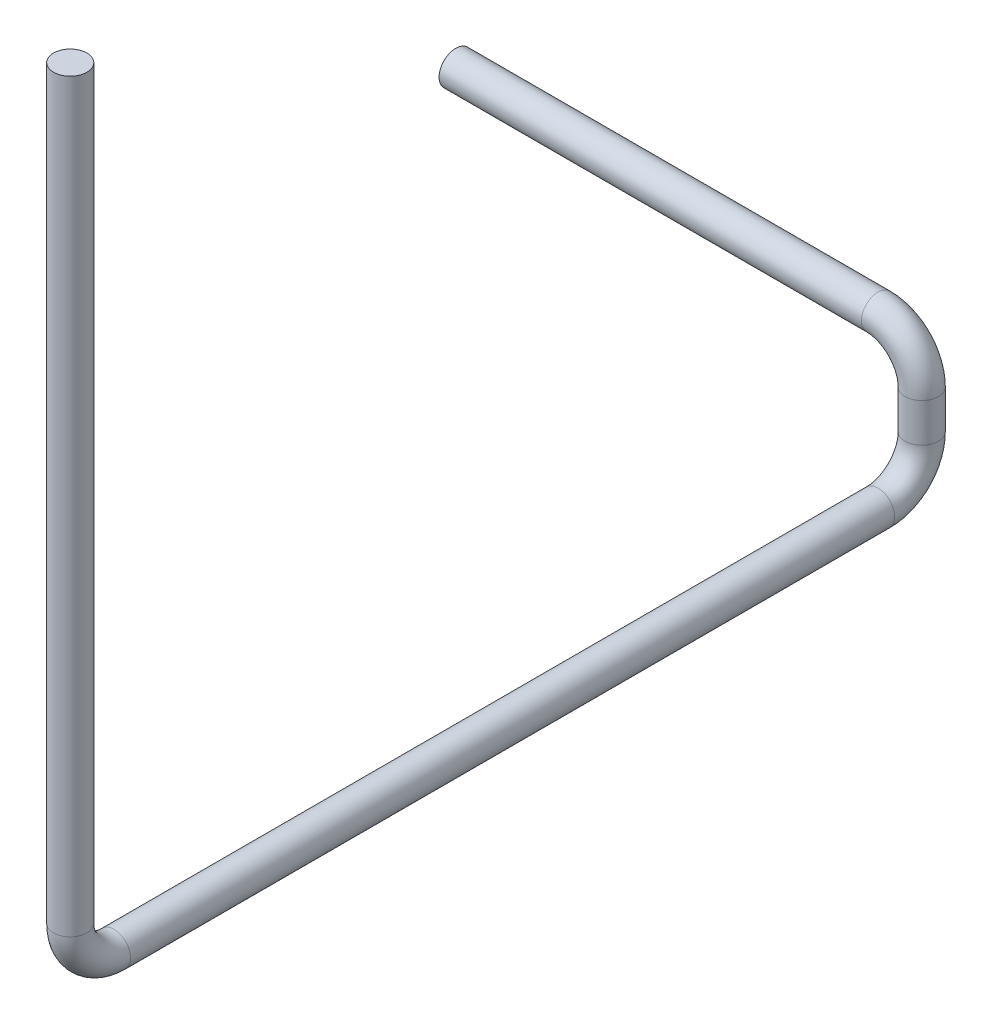
from build123d import *

# Parameters (mm, degrees)
BARRER2_PROFILE_R = 19.05


with BuildPart() as part:
    # Barrer2: sweep along a curve in space
    with BuildLine() as barrer2_path:
        Line((1117.590032513, -243.390046142, 2257.05), (1600.477366513, -243.390046142, 2257.05))
        ThreePointArc((1600.477366513, -243.390046142, 2257.05), (1635.832705573, -258.034707083, 2257.05), (1650.477366513, -293.390046142, 2257.05))
        Line((1650.477366513, -293.390046142, 2257.05), (1650.477366513, -337.599174546, 2257.05))
        ThreePointArc((1650.477366513, -337.599174546, 2257.05), (1650.477366513, -372.954513605, 2271.694660941), (1650.477366513, -387.599174546, 2307.05))
        Line((1650.477366513, -387.599174546, 2307.05), (1650.477366513, -387.599174546, 3180.805861))
        ThreePointArc((1650.477366513, -387.599174546, 3180.805861), (1650.477366513, -372.954513605, 3216.161200059), (1650.477366513, -337.599174546, 3230.805861))
        Line((1650.477366513, -337.599174546, 3230.805861), (1650.477366513, 514.750220824, 3230.805861))
    # Barrer2 profile (on start of the path) → Barrer2 (sweep)
    with BuildSketch(Plane(origin=(1117.590032513, -243.390046142, 2257.05), x_dir=(0, 0, 1), z_dir=(1, 0, 0))):
        Circle(BARRER2_PROFILE_R)
    sweep(path=barrer2_path.line)


solid = part.part
